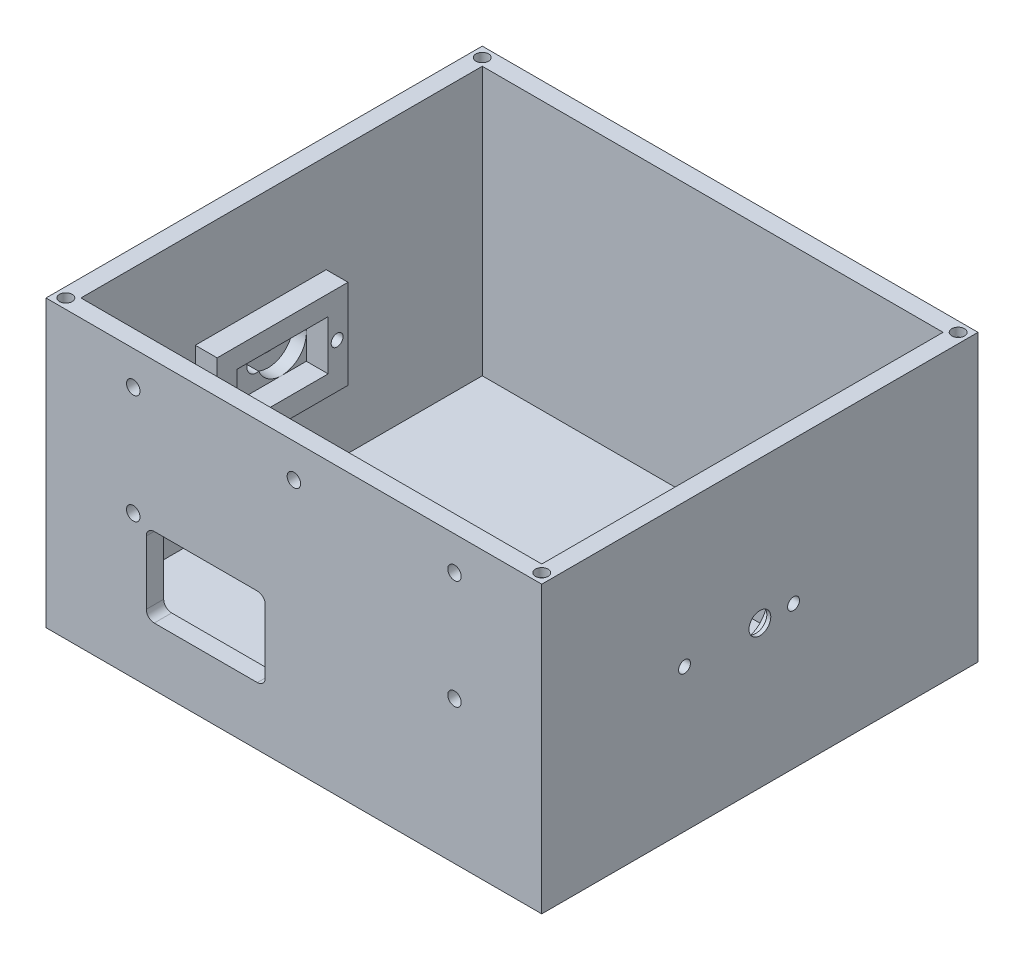
from build123d import *

# Parameters (mm, degrees)
SHELL_1_T                = -4.4
SKETCH_4_W               = 30
SKETCH_4_H               = 20
CUT_EXTRUDE_2_DEPTH      = 143.273012367
FILLET_1_R               = 2
SKETCH_6_W               = 23
SKETCH_6_H               = 12.5
EXTRUDE_1_DEPTH          = 5.5
SKETCH_7_R               = 1.5
CUT_EXTRUDE_3_DEPTH      = 147.482115115
SKETCH_8_R               = 1.6
CUT_EXTRUDE_4_DEPTH      = 2.2
CUT_EXTRUDE_1_DEPTH      = 3.4
CUT_EXTRUDE_START        = -3.4
CUT_EXTRUDE_5_DEPTH      = 3.4
CUT_EXTRUDE_6_DEPTH      = 154.574086519
CUT_EXTRUDE_6_DEPTH_BACK = 154.574086519
SKETCH_10_R              = 2.75
SKETCH_11_R              = 3
EXTRUDE_2_DEPTH          = 3
HOLE_WIZARD_M3_1_D       = 3.4
HOLE_WIZARD_M3_1_DEPTH   = 4.4001
EXTRUDE_3_DEPTH          = 3


with BuildPart() as part:
    # 草图1 → 放样1 section 0
    with BuildSketch(Plane(origin=(0, 0, 0), x_dir=(1, 0, 0), z_dir=(0, 1, 0))):
        with BuildLine():
            Line((-62.5, 55), (62.5, 55))
            Line((62.5, 55), (62.5, -55))
            Line((62.5, -55), (-62.5, -55))
            Line((-62.5, -55), (-62.5, 55))
        make_face()
    # 草图2 → 放样1 section 1
    with BuildSketch(Plane(origin=(0, 72, 0), x_dir=(1, 0, 0), z_dir=(0, 1, 0))):
        with BuildLine():
            Line((-62.5, 55), (62.5, 55))
            Line((62.5, 55), (62.5, -55))
            Line((62.5, -55), (-62.5, -55))
            Line((-62.5, -55), (-62.5, 55))
        make_face()
    loft()

    # 抽壳1
    shell_1_openings = [part.faces().sort_by_distance(p)[0] for p in [
        (0, 72, 0),
    ]]
    offset(amount=SHELL_1_T, openings=shell_1_openings, kind=Kind.INTERSECTION)

    # 草图4 → 切除-拉伸2 (cut, through all)
    with BuildSketch(Plane.XY.offset(50.6)):
        with Locations((-22.217899847, 24.659135412)):
            Rectangle(SKETCH_4_W, SKETCH_4_H)
    extrude(amount=CUT_EXTRUDE_2_DEPTH, mode=Mode.SUBTRACT)

    # 圆角1
    fillet_1_edges = [part.edges().sort_by_distance(p)[0] for p in [
        (-7.217899847, 14.659135412, 52.8),
        (-7.217899847, 34.659135412, 52.8),
        (-37.217899847, 34.659135412, 52.8),
        (-37.217899847, 14.659135412, 52.8),
    ]]
    fillet(fillet_1_edges, radius=FILLET_1_R)

    # 草图6 → 凸台-拉伸1 (add)
    with BuildSketch(Plane(origin=(-58.1, 0, 0), x_dir=(0, 0, -1), z_dir=(1, 0, 0))):
        Polygon((-21.75, 42.25), (-21.75, 47.25), (11.25, 47.25), (11.25, 42.25), (11.25, 29.74999898), (11.25, 24.75), (-21.75, 24.75), (-21.75, 29.74999898), align=None)
        with Locations((-5.25, 36)):
            Rectangle(SKETCH_6_W, SKETCH_6_H, mode=Mode.SUBTRACT)
    extrude_1 = extrude(amount=EXTRUDE_1_DEPTH)

    # 草图7 → 切除-拉伸3 (cut, through all)
    with BuildSketch(Plane(origin=(-52.6, 0, 0), x_dir=(0, 0, -1), z_dir=(1, 0, 0))):
        with Locations(Location((-19, 35.99999884, 0), (0, 0, 90))):
            Circle(SKETCH_7_R)
        with Locations(Location((8.5, 35.99999884, 0), (0, 0, 90))):
            Circle(SKETCH_7_R)
    cut_extrude_3 = extrude(amount=-CUT_EXTRUDE_3_DEPTH, mode=Mode.SUBTRACT)

    # 镜向1: 凸台-拉伸1, 切除-拉伸3 across plane
    add(extrude_1.mirror(Plane(origin=(0, 0, 0), x_dir=(0, 0, 1), z_dir=(1, 0, 0))))
    add(cut_extrude_3.mirror(Plane(origin=(0, 0, 0), x_dir=(0, 0, 1), z_dir=(1, 0, 0))), mode=Mode.SUBTRACT)

    # 草图8 → 切除-拉伸4 (cut)
    with BuildSketch(Plane(origin=(0, 72, 0), x_dir=(1, 0, 0), z_dir=(0, 1, 0))):
        with Locations(Location((-60, 52.5, 0), (0, 0, 270))):
            Circle(SKETCH_8_R)
        with Locations(Location((-60, -52.5, 0), (0, 0, 270))):
            Circle(SKETCH_8_R)
        with Locations(Location((60, -52.5, 0), (0, 0, 270))):
            Circle(SKETCH_8_R)
        with Locations(Location((60, 52.5, 0), (0, 0, 270))):
            Circle(SKETCH_8_R)
    extrude(amount=-CUT_EXTRUDE_4_DEPTH, mode=Mode.SUBTRACT)

    # 草图3 → 切除-拉伸1 (cut)
    with BuildSketch(Plane(origin=(-58.1, 0, 0), x_dir=(0, 0, -1), z_dir=(1, 0, 0))):
        with BuildLine():
            ThreePointArc((-5.75, 38.449489743), (-8.75, 36), (-5.75, 33.550510257))
            ThreePointArc((-5.75, 33.550510257), (6.25, 36), (-5.75, 38.449489743))
        make_face()
    extrude(amount=-CUT_EXTRUDE_1_DEPTH, mode=Mode.SUBTRACT)

    # 草图9 → 切除-拉伸5 (cut)
    with BuildSketch(Plane.ZY.offset(-58.1).offset(CUT_EXTRUDE_START)):
        with BuildLine():
            ThreePointArc((5.75, 38.449489743), (-6.25, 36), (5.75, 33.550510257))
            ThreePointArc((5.75, 33.550510257), (8.75, 36), (5.75, 38.449489743))
        make_face()
    extrude(amount=CUT_EXTRUDE_5_DEPTH, mode=Mode.SUBTRACT)

    # 草图10 → 切除-拉伸6 (cut, two sides: drawn at the far end of the back side and taken through both)
    with BuildSketch(Plane(origin=(-61.5, 0, 0), x_dir=(0, 0, -1), z_dir=(1, 0, 0)).offset(-CUT_EXTRUDE_6_DEPTH_BACK)):
        with Locations(Location((0, 36, 0), (0, 0, 270))):
            Circle(SKETCH_10_R)
    extrude(amount=CUT_EXTRUDE_6_DEPTH + CUT_EXTRUDE_6_DEPTH_BACK, mode=Mode.SUBTRACT)

    # 草图11 → 凸台-拉伸2 (add)
    with BuildSketch(Plane(origin=(0, 0, -55), x_dir=(-1, 0, 0), z_dir=(0, 0, -1))):
        with Locations(Location((42.5, 24.543593294, 0), (0, 0, 270))):
            Circle(SKETCH_11_R)
        with Locations(Location((24.5, 24.543593294, 0), (0, 0, 270))):
            Circle(SKETCH_11_R)
    extrude(amount=EXTRUDE_2_DEPTH)

    # M3 间隙孔1
    with Locations(Plane(origin=(0, 0, 50.6), x_dir=(-1, 0, 0), z_dir=(0, 0, -1))):
        with Locations((-40.5, 63.5), (0, 63.5), (40.5, 63.5), (40.5, 36), (-40.5, 36)):
            Hole(HOLE_WIZARD_M3_1_D / 2, depth=HOLE_WIZARD_M3_1_DEPTH)

    # 草图15 → 凸台-拉伸3 (add)
    with BuildSketch(Plane(origin=(0, 0, 50.6), x_dir=(-1, 0, 0), z_dir=(0, 0, -1))):
        Polygon((-29.1, 60.00000762), (-29.1, 58), (-33.10001016, 58), (-33.10001016, 57), (-28.112700025, 57), (-28.1, 60.00000762), align=None)
        Polygon((-4.825356871, 58), (-4.825356871, 60.00000762), (-5.825356871, 60.00000762), (-5.825356871, 57.012700025), (-0.825346711, 57), (-0.825346711, 58), align=None)
        Polygon((-4.825356871, 32.025351791), (-0.825346711, 32.025351791), (-0.825346711, 33.025351791), (-5.825356871, 33.012651765), (-5.825356871, 30.025344171), (-4.825356871, 30.025344171), align=None)
        Polygon((-29.1, 32.025351791), (-29.1, 30.025344171), (-28.1, 30.025344171), (-28.1, 33.012651765), (-28.1, 33.025351791), (-33.10001016, 33.025351791), (-33.10001016, 32.025351791), align=None)
    extrude(amount=EXTRUDE_3_DEPTH)


solid = part.part
